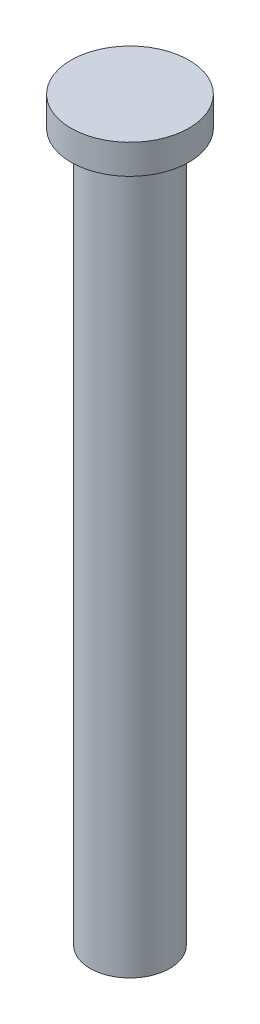
from build123d import *

# Parameters (mm, degrees)
SKETCH1_R           = 6.75
BOSS_EXTRUDE1_DEPTH = 120
SKETCH2_R           = 10
BOSS_EXTRUDE2_DEPTH = 5


with BuildPart() as part:
    # Sketch1 → Boss-Extrude1 (new body)
    with BuildSketch(Plane(origin=(0, 0, 0), x_dir=(1, 0, 0), z_dir=(0, 1, 0))):
        with Locations(Location((0, 0, 0), (0, 0, 270))):
            Circle(SKETCH1_R)
    extrude(amount=BOSS_EXTRUDE1_DEPTH)

    # Sketch2 → Boss-Extrude2 (add)
    with BuildSketch(Plane(origin=(0, 120, 0), x_dir=(1, 0, 0), z_dir=(0, 1, 0))):
        with Locations(Location((0, 0, 0), (0, 0, 270))):
            Circle(SKETCH2_R)
    extrude(amount=BOSS_EXTRUDE2_DEPTH)


solid = part.part
